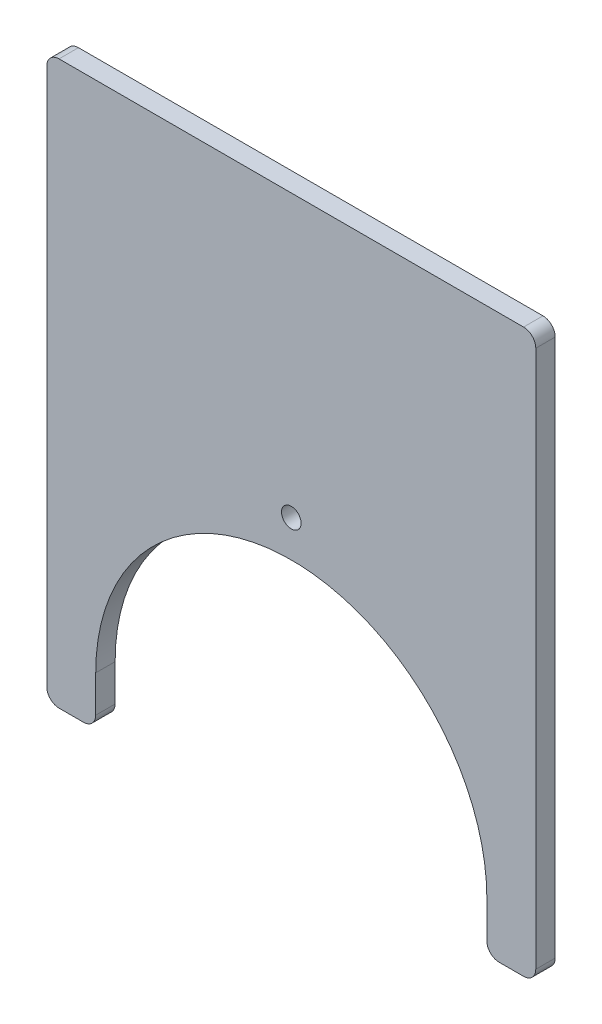
from build123d import *

# Parameters (mm, degrees)
SKETCH1_W           = 400
SKETCH1_H           = 460
BOSS_EXTRUDE1_DEPTH = 15.875
CUT_EXTRUDE1_DEPTH  = 306.208151308
FILLET1_R           = 10
SKETCH3_R           = 8
CUT_EXTRUDE2_DEPTH  = 306.208151308


with BuildPart() as part:
    # Sketch1 → Boss-Extrude1 (new body)
    with BuildSketch(Plane.XY):
        Rectangle(SKETCH1_W, SKETCH1_H)
    extrude(amount=-BOSS_EXTRUDE1_DEPTH)

    # Sketch2 → Cut-Extrude1 (cut, through all)
    with BuildSketch(Plane.XY):
        with BuildLine():
            Line((160, -230), (160, -190))
            ThreePointArc((160, -190), (0, -30), (-160, -190))
            Line((-160, -190), (-160, -230))
            Line((-160, -230), (160, -230))
        make_face()
    extrude(amount=-CUT_EXTRUDE1_DEPTH, mode=Mode.SUBTRACT)

    # Fillet1
    fillet1_edges = [part.edges().sort_by_distance(p)[0] for p in [
        (160, -230, -7.9375),
        (-160, -230, -7.9375),
        (200, -230, -7.9375),
        (-200, -230, -7.9375),
        (-200, 230, -7.9375),
        (200, 230, -7.9375),
    ]]
    fillet(fillet1_edges, radius=FILLET1_R)

    # Sketch3 → Cut-Extrude2 (cut, through all)
    with BuildSketch(Plane.XY):
        Circle(SKETCH3_R)
    extrude(amount=-CUT_EXTRUDE2_DEPTH, mode=Mode.SUBTRACT)


solid = part.part
